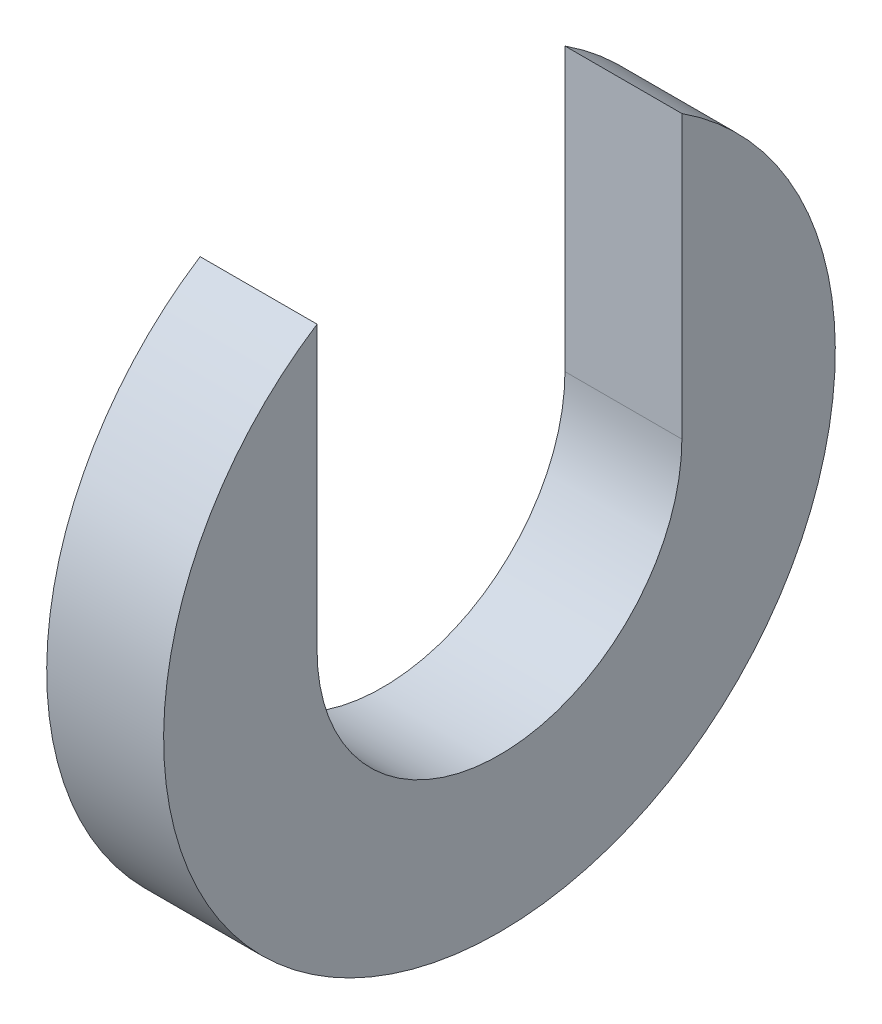
from build123d import *

# Parameters (mm, degrees)
BOSS_EXTRUDE1_DEPTH = 3.175


with BuildPart() as part:
    # Sketch2 → Boss-Extrude1 (new body)
    with BuildSketch(Plane(origin=(0, 0, 0), x_dir=(0, 0, -1), z_dir=(1, 0, 0))):
        with BuildLine():
            Line((-4.953, 0), (-4.953, 7.656151576))
            ThreePointArc((-4.953, 7.656151576), (0, -9.1186), (4.953, 7.656151576))
            Line((4.953, 7.656151576), (4.953, 0))
            ThreePointArc((4.953, 0), (0, -4.953), (-4.953, 0))
        make_face()
    extrude(amount=BOSS_EXTRUDE1_DEPTH)


solid = part.part
